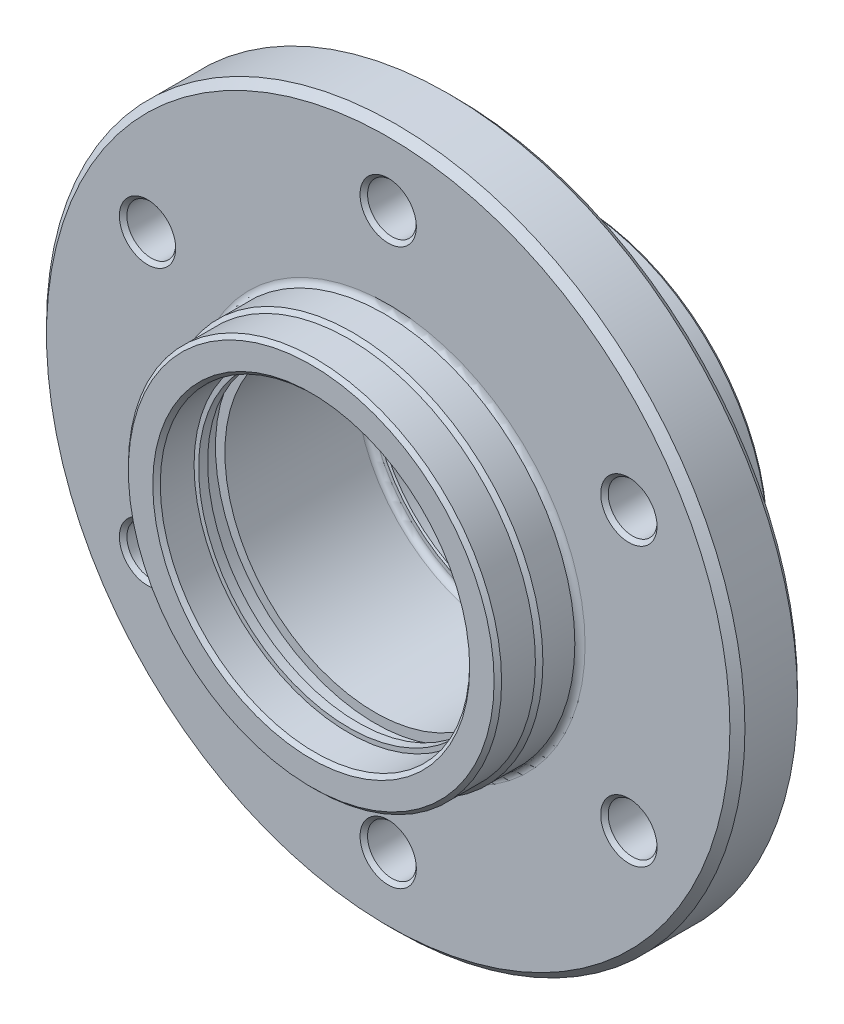
from build123d import *

# Parameters (mm, degrees)
CROQUIS2_R            = 3.25
CORTAR_EXTRUIR1_DEPTH = 71.334930867
CHAFL_N1_SIZE         = 0.5


with BuildPart() as part:
    # Croquis1 → Revolución1 (revolve)
    with BuildSketch(Plane(origin=(0, 0, 0), x_dir=(0, 0, -1), z_dir=(1, 0, 0)), mode=Mode.PRIVATE) as revoluci_n1_sk:
        with BuildLine():
            Line((-9, 26.216025404), (-9, 45.5))
            Line((-9, 45.5), (-8, 46.5))
            Line((-8, 46.5), (-1, 46.5))
            Line((-1, 46.5), (0, 45.5))
            Line((0, 45.5), (0, 26))
            ThreePointArc((0, 26), (0.3, 25.7), (0.6, 26))
            Line((0.6, 26), (15.45, 26))
            Line((15.45, 26), (15.95, 25.5))
            Line((15.95, 25.5), (15.95, 21.1))
            Line((15.95, 21.1), (15.45, 20.6))
            Line((15.45, 20.6), (10.95, 20.6))
            Line((10.95, 20.6), (10.95, 18.7))
            Line((10.95, 18.7), (10.75, 18.5))
            Line((10.75, 18.5), (7.65, 18.5))
            Line((7.65, 18.5), (7.45, 18.7))
            Line((7.45, 18.7), (7.45, 19.2))
            ThreePointArc((7.45, 19.2), (7.215685425, 19.765685425), (6.65, 20))
            Line((6.65, 20), (-10.75, 20))
            Line((-10.75, 20), (-10.75, 21.25))
            Line((-10.75, 21.25), (-13.05, 21.25))
            Line((-13.05, 21.25), (-13.05, 20))
            Line((-13.05, 20), (-14.25, 20))
            Line((-14.25, 20), (-14.25, 20.6))
            Line((-14.25, 20.6), (-18.75, 20.6))
            Line((-18.75, 20.6), (-19.25, 21.1))
            Line((-19.25, 21.1), (-19.25, 24.35))
            Line((-19.25, 24.35), (-18.75, 24.85))
            Line((-18.75, 24.85), (-14.25, 24.85))
            Line((-14.25, 24.85), (-13.75, 25.35))
            Line((-13.75, 25.35), (-9.5, 25.35))
            ThreePointArc((-9.5, 25.35), (-9.133974596, 25.716025404), (-9, 26.216025404))
        make_face()
    revolve(revoluci_n1_sk.sketch.rotate(Axis((0, 0, 23.302641181), (0, 0, -1)), 90), axis=Axis((0, 0, 23.302641181), (0, 0, -1)))

    # Croquis2 → Cortar-Extruir1 (cut, through all)
    with BuildSketch(Plane.XY.offset(9)):
        with Locations((0, 37)):
            Circle(CROQUIS2_R)
        with Locations((32.04293994, 18.5)):
            Circle(CROQUIS2_R)
        with Locations((32.04293994, -18.5)):
            Circle(CROQUIS2_R)
        with Locations((0, -37)):
            Circle(CROQUIS2_R)
        with Locations((-32.04293994, -18.5)):
            Circle(CROQUIS2_R)
        with Locations((-32.04293994, 18.5)):
            Circle(CROQUIS2_R)
    extrude(amount=-CORTAR_EXTRUIR1_DEPTH, mode=Mode.SUBTRACT)

    # Chaflán1
    chafl_n1_edges = [part.edges().sort_by_distance(p)[0] for p in [
        (-3.25, 37, 0),
        (-3.25, 37, 9),
        (-35.29293994, 18.5, 0),
        (-35.29293994, 18.5, 9),
        (-35.29293994, -18.5, 0),
        (-35.29293994, -18.5, 9),
        (-3.25, -37, 0),
        (-3.25, -37, 9),
        (28.79293994, -18.5, 0),
        (28.79293994, -18.5, 9),
        (28.79293994, 18.5, 0),
        (28.79293994, 18.5, 9),
    ]]
    chamfer(chafl_n1_edges, length=CHAFL_N1_SIZE)


solid = part.part
